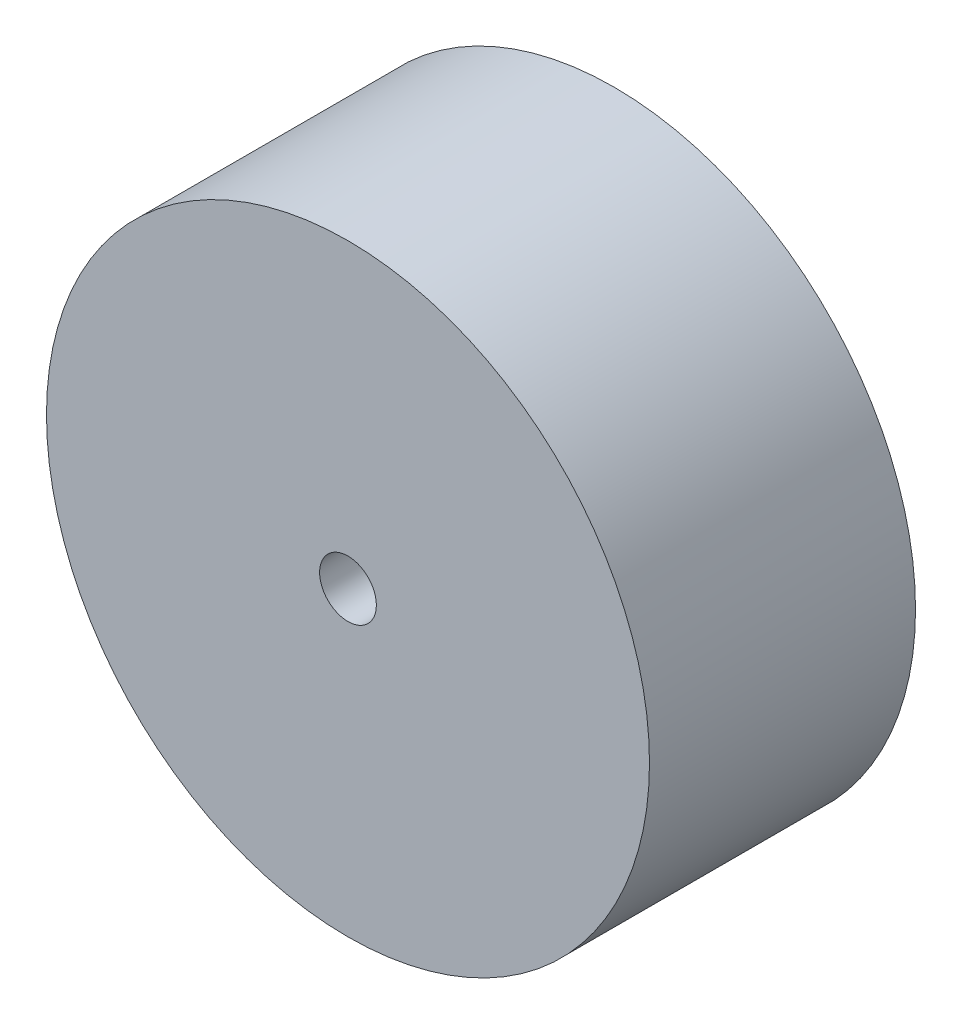
from build123d import *

# Parameters (mm, degrees)
SKETCH1_R           = 17
SKETCH1_R_2         = 1.6
BOSS_EXTRUDE1_DEPTH = 15


with BuildPart() as part:
    # Sketch1 → Boss-Extrude1 (new body)
    with BuildSketch(Plane.XY):
        Circle(SKETCH1_R)
        Circle(SKETCH1_R_2, mode=Mode.SUBTRACT)
    extrude(amount=BOSS_EXTRUDE1_DEPTH)


solid = part.part
